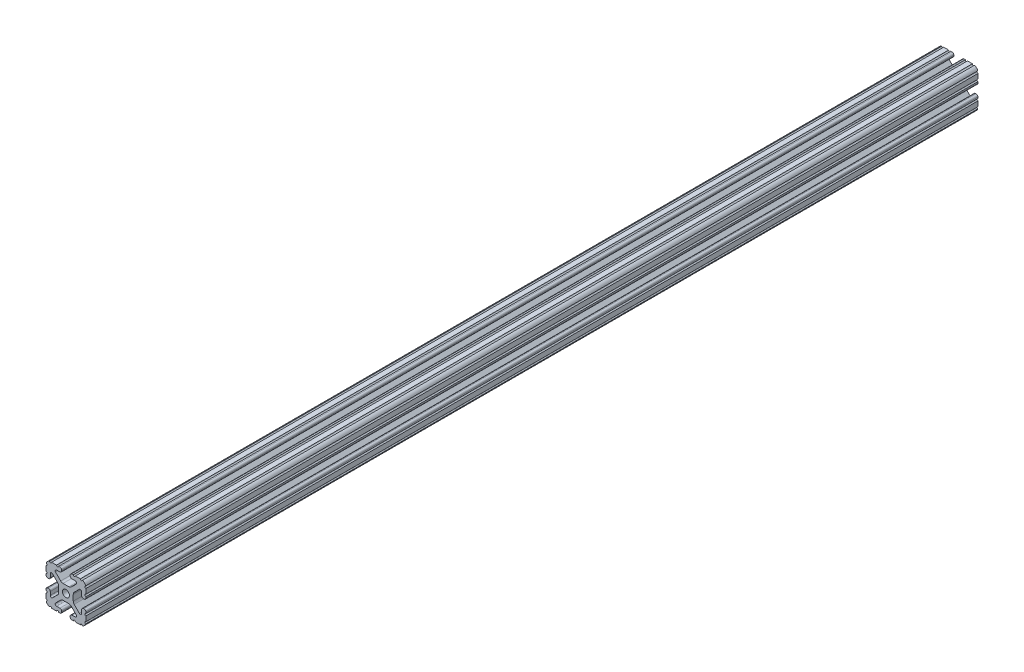
from build123d import *

# Parameters (mm, degrees)
BOSS_EXTRUDE1_DEPTH     = 426.2
CUT_EXTRUDE1_DEPTH      = 428.050635171
CUT_EXTRUDE1_DEPTH_BACK = 428.050635171
SKETCH5_R               = 1.016


with BuildPart() as part:
    # Sketch4 → Boss-Extrude1 (new, symmetric)
    with BuildSketch(Plane.XY):
        with BuildLine():
            Line((5.7912, -19.05), (14.3002, -19.05))
            ThreePointArc((14.3002, -19.05), (17.658815789, -17.658815789), (19.05, -14.3002))
            Line((19.05, -14.3002), (19.05, -5.7912))
            ThreePointArc((19.05, -5.7912), (18.544114832, -4.569885168), (17.3228, -4.064))
            Line((17.3228, -4.064), (16.7132, -4.064))
            ThreePointArc((16.7132, -4.064), (15.491885168, -4.569885168), (14.986, -5.7912))
            Line((14.986, -5.7912), (14.986, -8.996305235))
            ThreePointArc((14.986, -8.996305235), (14.189232738, -10.188751711), (12.782646215, -9.908964256))
            Line((12.782646215, -9.908964256), (7.888897763, -5.015215804))
            ThreePointArc((7.888897763, -5.015215804), (7.219915375, -4.014012907), (6.985, -2.833013566))
            Line((6.985, -2.833013566), (6.985, 0))
            Line((6.985, 0), (3.3274, 0))
            ThreePointArc((3.3274, 0), (2.352827104, -2.352827104), (0, -3.3274))
            Line((0, -3.3274), (0, -6.985))
            Line((0, -6.985), (2.833013566, -6.985))
            ThreePointArc((2.833013566, -6.985), (4.014012907, -7.219915375), (5.015215804, -7.888897763))
            Line((5.015215804, -7.888897763), (9.908964256, -12.782646215))
            ThreePointArc((9.908964256, -12.782646215), (10.188751711, -14.189232738), (8.996305235, -14.986))
            Line((8.996305235, -14.986), (5.7912, -14.986))
            ThreePointArc((5.7912, -14.986), (4.569885168, -15.491885168), (4.064, -16.7132))
            Line((4.064, -16.7132), (4.064, -17.3228))
            ThreePointArc((4.064, -17.3228), (4.569885168, -18.544114832), (5.7912, -19.05))
        make_face()
    extrude(amount=BOSS_EXTRUDE1_DEPTH, both=True)

    # Sketch5 → Cut-Extrude1 (cut, two sides: drawn at the far end of the back side and taken through both)
    with BuildSketch(Plane.XY.offset(-CUT_EXTRUDE1_DEPTH_BACK)):
        with Locations((14.739477062, -19.05)):
            Circle(SKETCH5_R)
        with Locations((7.980305235, -19.05)):
            Circle(SKETCH5_R)
        with Locations((19.05, -14.739477062)):
            Circle(SKETCH5_R)
        with Locations((19.05, -7.980305235)):
            Circle(SKETCH5_R)
    extrude(amount=CUT_EXTRUDE1_DEPTH + CUT_EXTRUDE1_DEPTH_BACK, mode=Mode.SUBTRACT)

    # Mirror1: part across plane


with BuildPart() as part_1:
    add(part.part)
    add(part.part.mirror(Plane(origin=(0, 0, 0), x_dir=(0, 0, 1), z_dir=(1, 0, 0))))

    # Mirror2: part across plane


with BuildPart() as part_2:
    add(part_1.part)
    add(part_1.part.mirror(Plane.ZX))


solid = part_2.part
